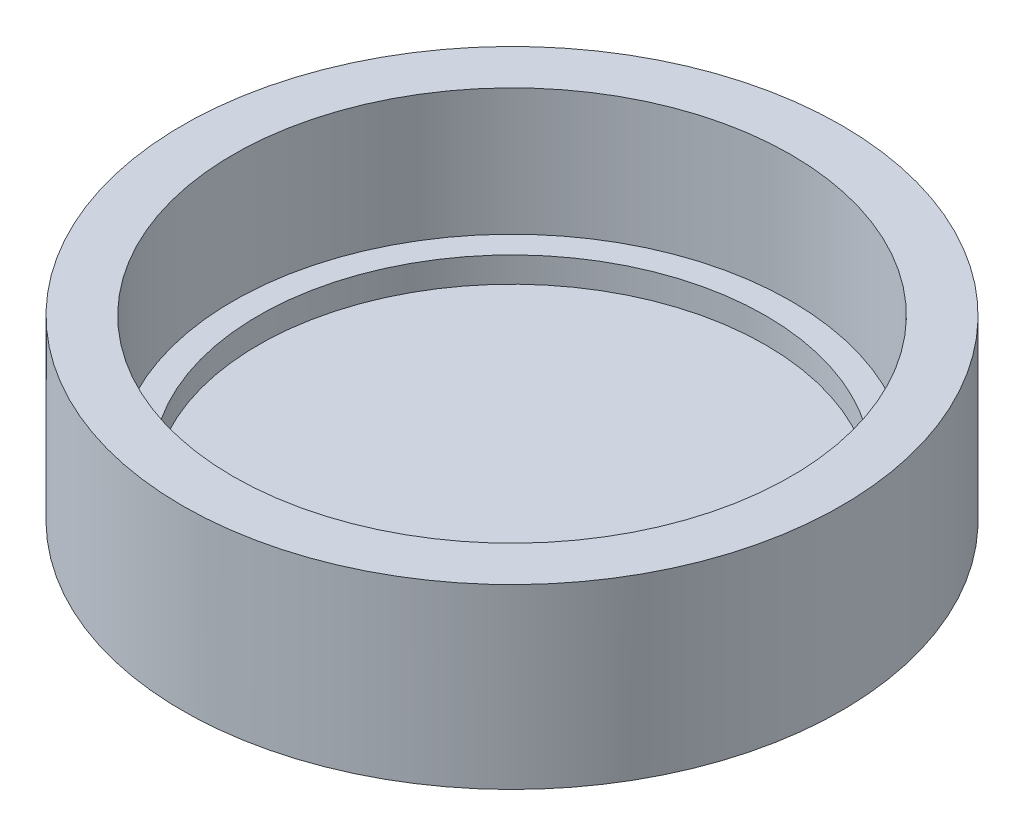
from build123d import *

# Parameters (mm, degrees)
ESQUISSE1_R        = 13
ESQUISSE1_R_2      = 11
BOSS_EXTRU_1_DEPTH = 6
BOSS_EXTRU_2_START = 1
ESQUISSE2_R        = 13
BOSS_EXTRU_2_DEPTH = 1
ESQUISSE3_R        = 11
ESQUISSE3_R_2      = 10
BOSS_EXTRU_3_DEPTH = 1


with BuildPart() as part:
    # Esquisse1 → Boss.-Extru.1 (new body)
    with BuildSketch(Plane(origin=(0, 0, 0), x_dir=(1, 0, 0), z_dir=(0, 1, 0))):
        with Locations(Location((0, 0, 0), (0, 0, 270))):
            Circle(ESQUISSE1_R)
        with Locations(Location((0, 0, 0), (0, 0, 270))):
            Circle(ESQUISSE1_R_2, mode=Mode.SUBTRACT)
    extrude(amount=BOSS_EXTRU_1_DEPTH)

    # Esquisse2 → Boss.-Extru.2 (add)
    with BuildSketch(Plane.XZ.offset(BOSS_EXTRU_2_START)):
        with Locations(Location((0, 0, 0), (0, 0, 270))):
            Circle(ESQUISSE2_R)
    extrude(amount=-BOSS_EXTRU_2_DEPTH)

    # Esquisse3 → Boss.-Extru.3 (add)
    with BuildSketch(Plane(origin=(0, 0, 0), x_dir=(1, 0, 0), z_dir=(0, 1, 0))):
        with Locations(Location((0, 0, 0), (0, 0, 270))):
            Circle(ESQUISSE3_R)
        with Locations(Location((0, 0, 0), (0, 0, 270))):
            Circle(ESQUISSE3_R_2, mode=Mode.SUBTRACT)
    extrude(amount=BOSS_EXTRU_3_DEPTH)


solid = part.part
